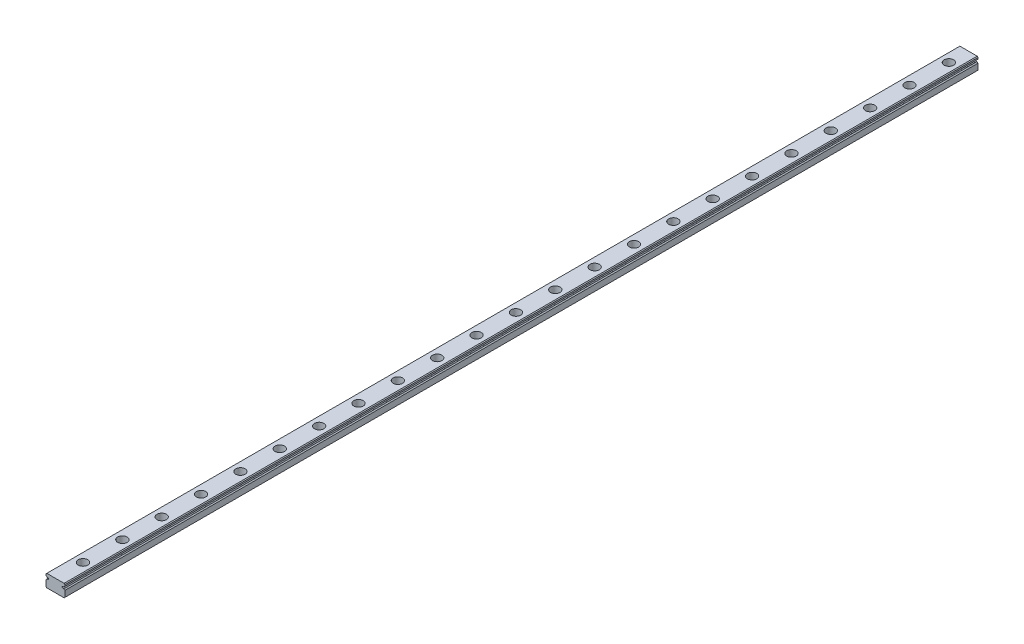
from build123d import *

# Parameters (mm, degrees)
BOSS_EXTRUDE1_DEPTH = 580
SKETCH2_R           = 3
CUT_EXTRUDE1_DEPTH  = 4.5
SKETCH3_R           = 1.75
CUT_EXTRUDE2_DEPTH  = 581.048489352
LPATTERN1_COUNT     = 23
LPATTERN1_PITCH     = 25


with BuildPart() as part:
    # Sketch1 → Boss-Extrude1 (new body)
    with BuildSketch(Plane.XY):
        with BuildLine():
            Line((6, -3.5), (6, 0.368911094))
            ThreePointArc((6, 0.368911094), (5.63354293, 0.61854293), (5.383911094, 0.985))
            Line((5.383911094, 0.985), (4.92112495, 0.985))
            ThreePointArc((4.92112495, 0.985), (4.265, 1.46), (4.92112495, 1.935))
            Line((4.92112495, 1.935), (5.383911094, 1.935))
            ThreePointArc((5.383911094, 1.935), (5.63354293, 2.30145707), (6, 2.551088906))
            Line((6, 2.551088906), (6, 3.5))
            Line((6, 3.5), (5.5, 4))
            Line((5.5, 4), (-5.5, 4))
            Line((-5.5, 4), (-6, 3.5))
            Line((-6, 3.5), (-6, 2.551088906))
            ThreePointArc((-6, 2.551088906), (-5.63354293, 2.30145707), (-5.383911094, 1.935))
            Line((-5.383911094, 1.935), (-4.92112495, 1.935))
            ThreePointArc((-4.92112495, 1.935), (-4.265, 1.46), (-4.92112495, 0.985))
            Line((-4.92112495, 0.985), (-5.383911094, 0.985))
            ThreePointArc((-5.383911094, 0.985), (-5.63354293, 0.61854293), (-6, 0.368911094))
            Line((-6, 0.368911094), (-6, -3.5))
            Line((-6, -3.5), (-5.5, -4))
            Line((-5.5, -4), (5.5, -4))
            Line((5.5, -4), (6, -3.5))
        make_face()
    extrude(amount=BOSS_EXTRUDE1_DEPTH)

    # Sketch2 → Cut-Extrude1 (cut)
    with BuildSketch(Plane(origin=(0, 4, 0), x_dir=(1, 0, 0), z_dir=(0, 1, 0))):
        with Locations(Location((0, -12.5, 0), (0, 0, 180))):
            Circle(SKETCH2_R)
    cut_extrude1 = extrude(amount=-CUT_EXTRUDE1_DEPTH, mode=Mode.SUBTRACT)

    # Sketch3 → Cut-Extrude2 (cut, through all)
    with BuildSketch(Plane(origin=(0, -0.5, 0), x_dir=(1, 0, 0), z_dir=(0, 1, 0))):
        with Locations(Location((0, -12.5, 0), (0, 0, 180))):
            Circle(SKETCH3_R)
    cut_extrude2 = extrude(amount=-CUT_EXTRUDE2_DEPTH, mode=Mode.SUBTRACT)

    # LPattern1: Cut-Extrude1, Cut-Extrude2 ×23
    with Locations(*[(0, 0, i * LPATTERN1_PITCH) for i in range(1, LPATTERN1_COUNT)]):
        add(cut_extrude1, mode=Mode.SUBTRACT)
        add(cut_extrude2, mode=Mode.SUBTRACT)


solid = part.part
